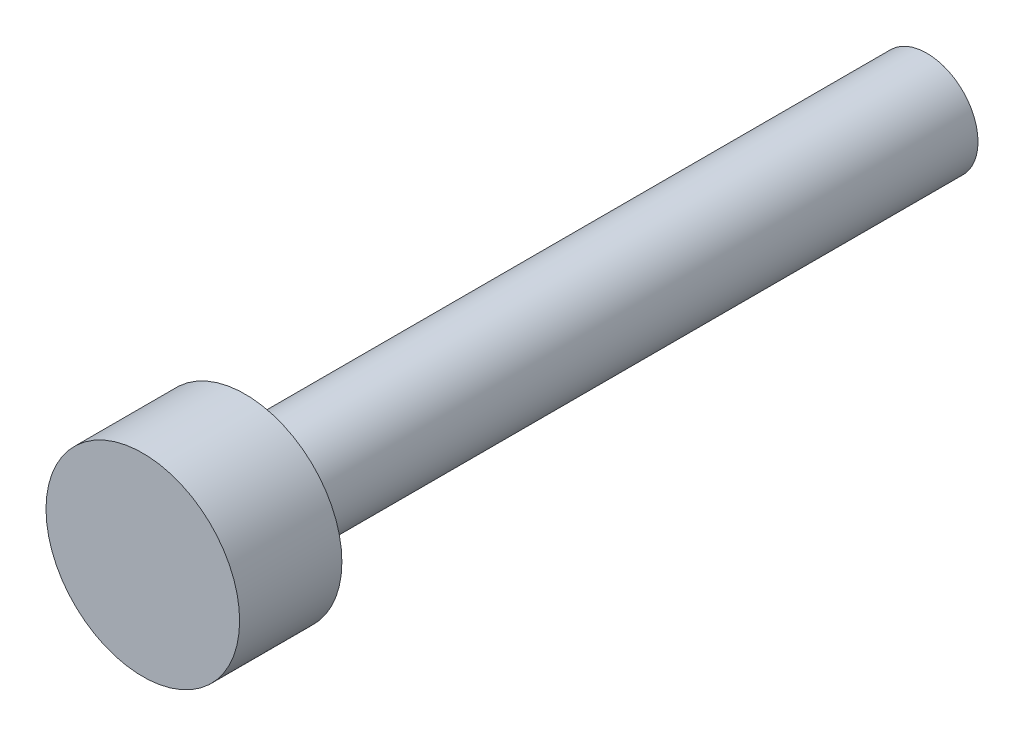
from build123d import *

# Parameters (mm, degrees)
SKETCH1_R           = 1.5
BOSS_EXTRUDE1_DEPTH = 20
SKETCH2_R           = 2.84
BOSS_EXTRUDE2_DEPTH = 3


with BuildPart() as part:
    # Sketch1 → Boss-Extrude1 (new body)
    with BuildSketch(Plane.XY):
        Circle(SKETCH1_R)
    extrude(amount=BOSS_EXTRUDE1_DEPTH)

    # Sketch2 → Boss-Extrude2 (add)
    with BuildSketch(Plane.XY.offset(20)):
        Circle(SKETCH2_R)
    extrude(amount=BOSS_EXTRUDE2_DEPTH)


solid = part.part
